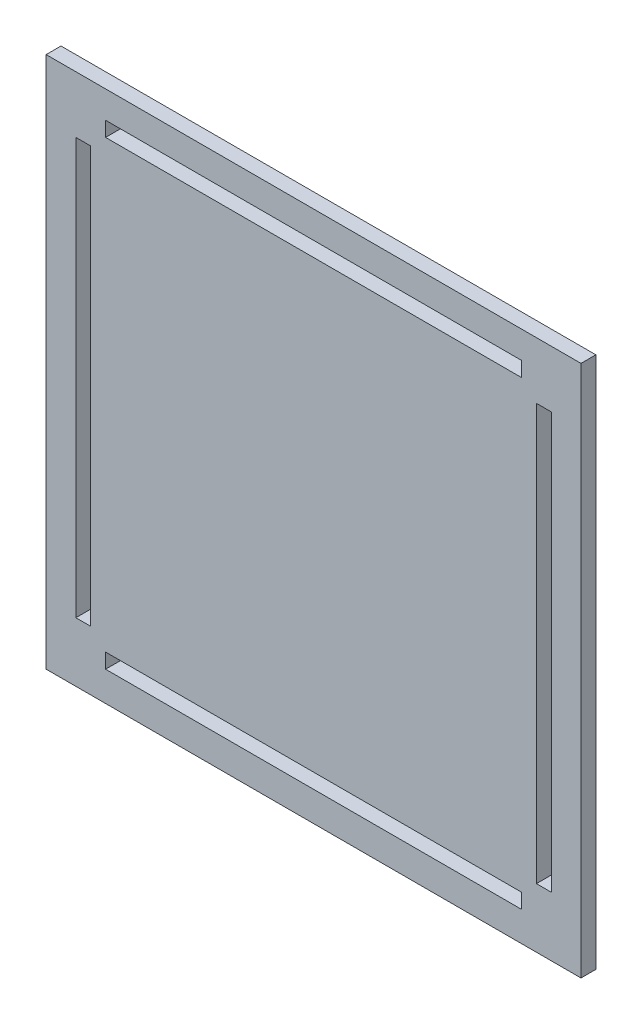
from build123d import *

# Parameters (mm, degrees)
ESQUISSE1_W        = 180
ESQUISSE1_H        = 179.14059872
ESQUISSE1_W_2      = 140
ESQUISSE1_H_2      = 5
ESQUISSE1_W_3      = 5
ESQUISSE1_H_3      = 140
BOSS_EXTRU_1_DEPTH = 5


with BuildPart() as part:
    # Esquisse1 → Boss.-Extru.1 (new body)
    with BuildSketch(Plane.XY):
        with Locations((0, -0.42970064)):
            Rectangle(ESQUISSE1_W, ESQUISSE1_H)
        with Locations((0, 77.5)):
            Rectangle(ESQUISSE1_W_2, ESQUISSE1_H_2, mode=Mode.SUBTRACT)
        with Locations((-77.5, 0)):
            Rectangle(ESQUISSE1_W_3, ESQUISSE1_H_3, mode=Mode.SUBTRACT)
        with Locations((77.5, 0)):
            Rectangle(ESQUISSE1_W_3, ESQUISSE1_H_3, mode=Mode.SUBTRACT)
        with Locations((0, -77.5)):
            Rectangle(ESQUISSE1_W_2, ESQUISSE1_H_2, mode=Mode.SUBTRACT)
    extrude(amount=BOSS_EXTRU_1_DEPTH)


solid = part.part
